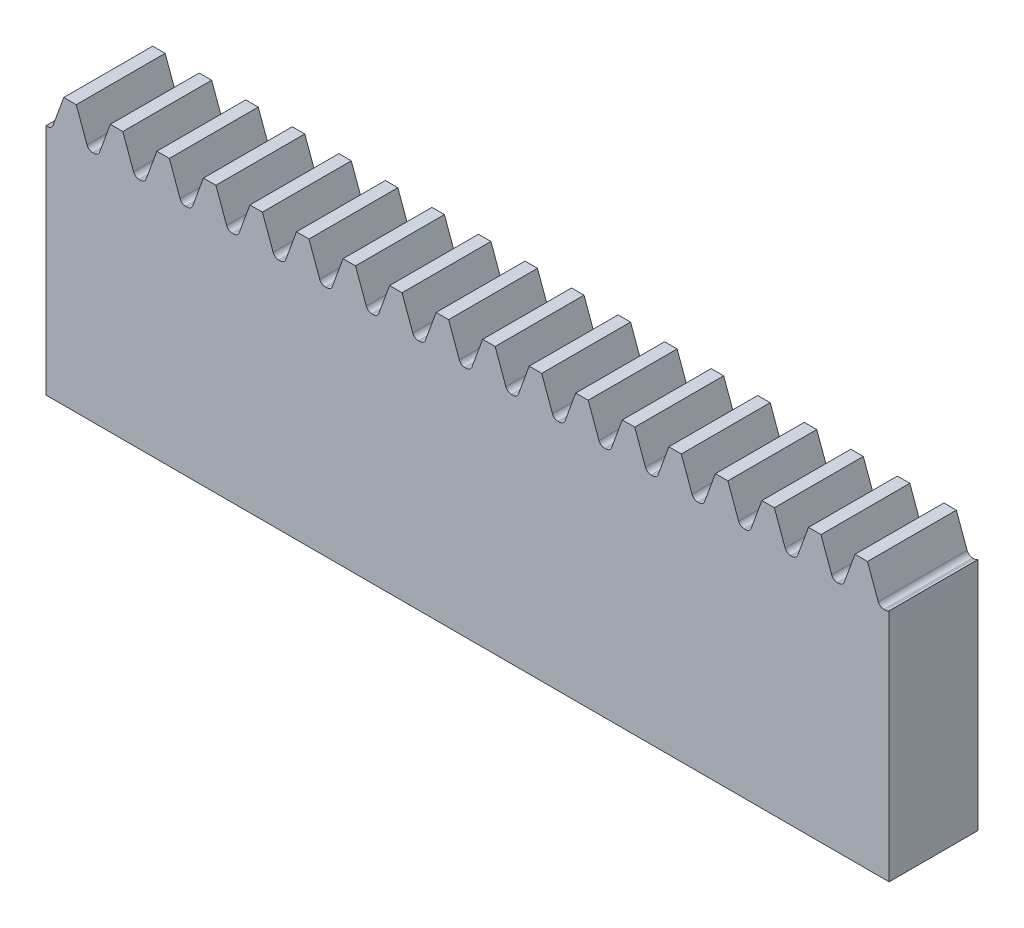
from build123d import *

# Parameters (mm, degrees)
SKETCH1_W           = 30
SKETCH1_H           = 9
BOSS_EXTRUDE1_DEPTH = 1.5
CUT_EXTRUDE1_DEPTH  = 32.464265445
LPATTERN1_COUNT     = 20
LPATTERN1_PITCH     = 1.570796327
SKETCH9_W           = 1.545620149
SKETCH9_H           = 3
CUT_EXTRUDE2_DEPTH  = 32.356817441


with BuildPart() as part:
    # Sketch1 → Boss-Extrude1 (new, symmetric)
    with BuildSketch(Plane.XY):
        with Locations((15, 4.5)):
            Rectangle(SKETCH1_W, SKETCH1_H)
    extrude(amount=BOSS_EXTRUDE1_DEPTH, both=True)

    # Sketch2 → Cut-Extrude1 (cut, through all)
    with BuildSketch(Plane.XY.offset(1.5)):
        with BuildLine():
            Line((-0.574684199, 9), (0.574684199, 9))
            Line((0.574684199, 9), (0.213114702, 8.006595971))
            ThreePointArc((0.213114702, 8.006595971), (0.139891465, 7.911169591), (0.025176178, 7.875))
            Line((0.025176178, 7.875), (-0.025176178, 7.875))
            ThreePointArc((-0.025176178, 7.875), (-0.139891465, 7.911169591), (-0.213114702, 8.006595971))
            Line((-0.213114702, 8.006595971), (-0.574684199, 9))
        make_face()
    cut_extrude1 = extrude(amount=-CUT_EXTRUDE1_DEPTH, mode=Mode.SUBTRACT)

    # LPattern1: Cut-Extrude1 ×20
    with Locations(*[(i * LPATTERN1_PITCH, 0, 0) for i in range(1, LPATTERN1_COUNT)]):
        add(cut_extrude1, mode=Mode.SUBTRACT)

    # Sketch9 → Cut-Extrude2 (cut, through all)
    with BuildSketch(Plane(origin=(0, 9, 0), x_dir=(1, 0, 0), z_dir=(0, 1, 0))):
        with Locations((0.772810075, 0)):
            Rectangle(SKETCH9_W, SKETCH9_H)
    extrude(amount=-CUT_EXTRUDE2_DEPTH, mode=Mode.SUBTRACT)


solid = part.part
